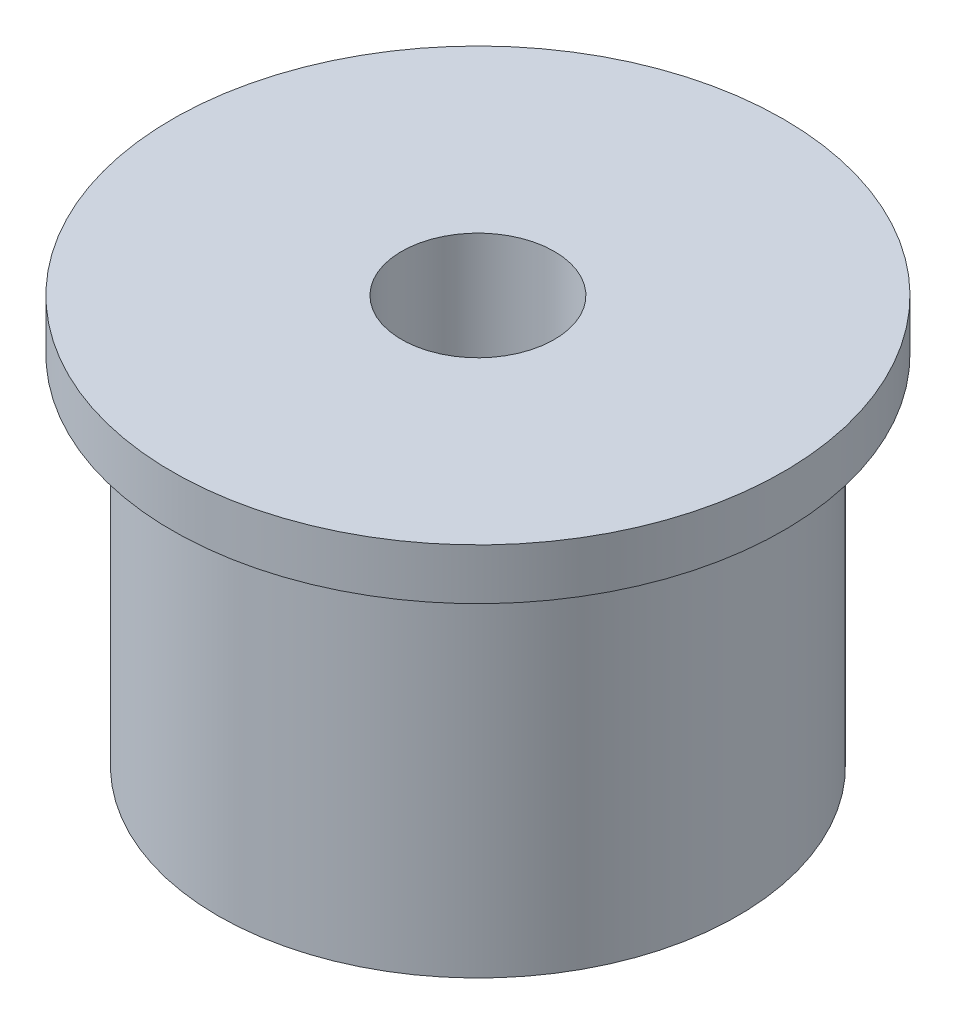
from build123d import *


with BuildPart() as part:
    # Sketch3 → Revolve1 (revolve)
    with BuildSketch(Plane.XY, mode=Mode.PRIVATE) as revolve1_sk:
        Polygon((-4.7625, 0), (-4.7625, 25.4), (-19.05, 25.4), (-19.05, 22.225), (-16.2052, 22.225), (-16.2052, 0), align=None)
    revolve(revolve1_sk.sketch.rotate(Axis((0, 0, 0), (0, 1, 0)), 270), axis=Axis((0, 0, 0), (0, 1, 0)))


solid = part.part
